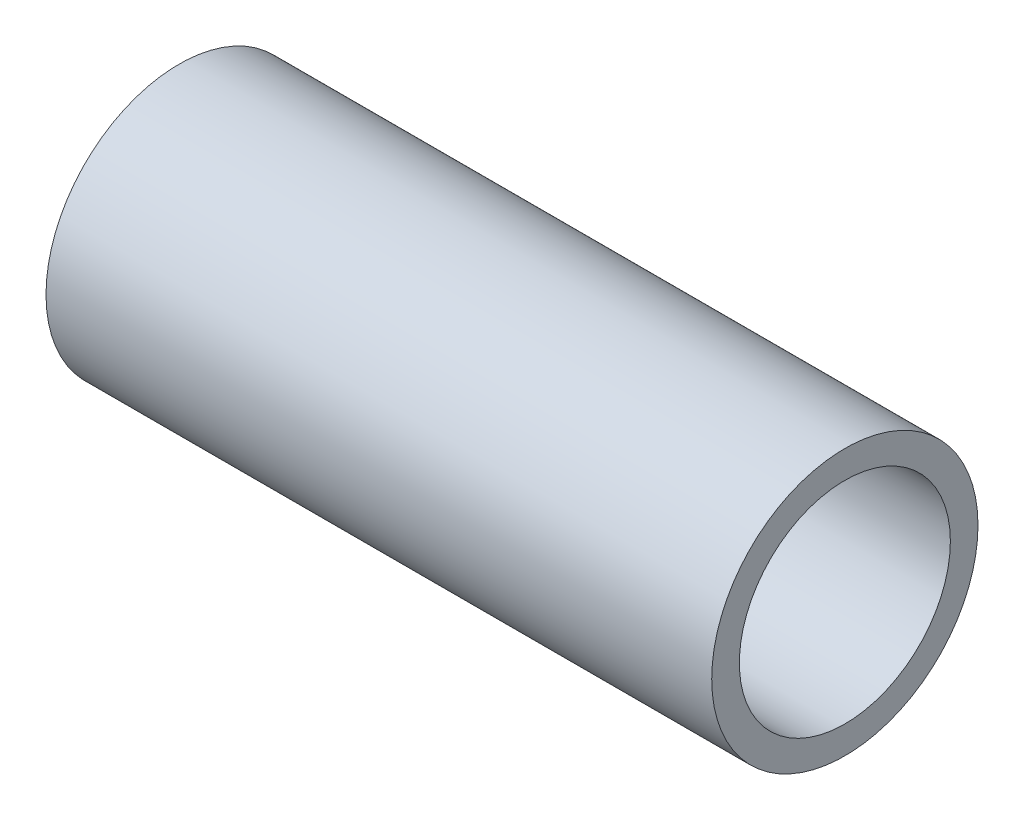
from build123d import *

# Parameters (mm, degrees)
SKETCH1_R           = 4
BOSS_EXTRUDE1_DEPTH = 20
SKETCH2_R           = 3.16992
CUT_EXTRUDE1_DEPTH  = 6.35


with BuildPart() as part:
    # Sketch1 → Boss-Extrude1 (new body)
    with BuildSketch(Plane(origin=(0, 0, 0), x_dir=(0, 0, -1), z_dir=(1, 0, 0))):
        Circle(SKETCH1_R)
    extrude(amount=BOSS_EXTRUDE1_DEPTH)

    # Sketch2 → Cut-Extrude1 (cut)
    with BuildSketch(Plane(origin=(20, 0, 0), x_dir=(0, 0, -1), z_dir=(1, 0, 0))):
        Circle(SKETCH2_R)
    extrude(amount=-CUT_EXTRUDE1_DEPTH, mode=Mode.SUBTRACT)


solid = part.part
